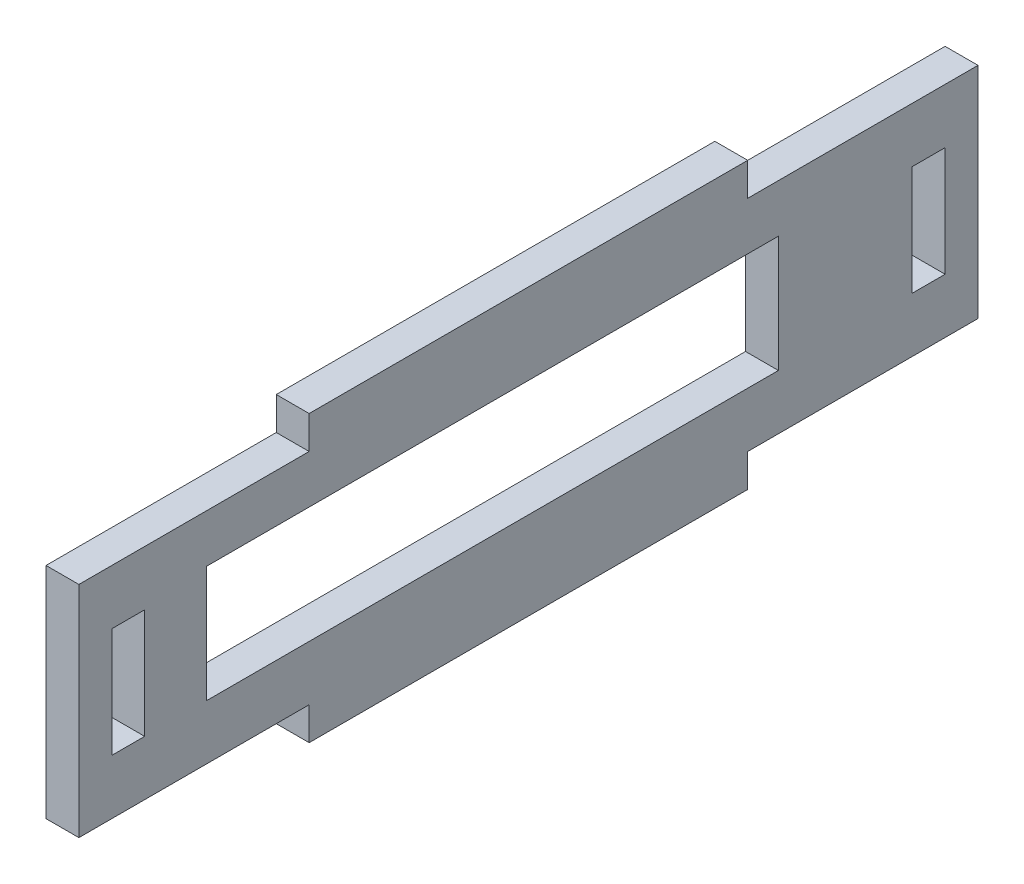
from build123d import *

# Parameters (mm, degrees)
SKETCH1_W           = 3
SKETCH1_H           = 10
SKETCH1_W_2         = 52.177317389
SKETCH1_H_2         = 10.6108985
BOSS_EXTRUDE1_DEPTH = 3


with BuildPart() as part:
    # Sketch1 → Boss-Extrude1 (new body)
    with BuildSketch(Plane(origin=(0, 0, 0), x_dir=(0, 0, -1), z_dir=(1, 0, 0))):
        Polygon((-6, 0), (-6, 20), (15, 20), (15, 23), (55, 23), (55, 20), (76, 20), (76, 0), (55, 0), (55, -3), (15, -3), (15, 0), align=None)
        with Locations((-1.5, 10)):
            Rectangle(SKETCH1_W, SKETCH1_H, mode=Mode.SUBTRACT)
        with Locations((71.5, 10)):
            Rectangle(SKETCH1_W, SKETCH1_H, mode=Mode.SUBTRACT)
        with Locations((31.710045475, 10.30544925)):
            Rectangle(SKETCH1_W_2, SKETCH1_H_2, mode=Mode.SUBTRACT)
    extrude(amount=BOSS_EXTRUDE1_DEPTH)


solid = part.part
